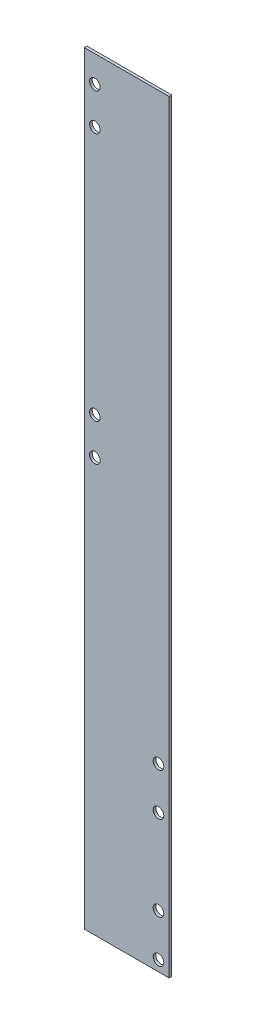
from build123d import *

# Parameters (mm, degrees)
SKETCH1_W          = 3.175
SKETCH1_H          = 914.4
EXTRUDE1_DEPTH     = 101.6
SKETCH3_R          = 6.35
CUT_EXTRUDE2_DEPTH = 50.8
SKETCH4_R          = 6.35
CUT_EXTRUDE3_DEPTH = 50.8


with BuildPart() as part:
    # Sketch1 → Extrude1 (new body)
    with BuildSketch(Plane(origin=(0, 0, 0), x_dir=(0, 0, -1), z_dir=(1, 0, 0))):
        with Locations((1.5875, -457.2)):
            Rectangle(SKETCH1_W, SKETCH1_H)
    extrude(amount=EXTRUDE1_DEPTH)

    # Sketch3 → Cut-Extrude2 (cut)
    with BuildSketch(Plane.XY):
        with Locations((88.9, -901.7)):
            Circle(SKETCH3_R)
        with Locations((88.9, -850.9)):
            Circle(SKETCH3_R)
        with Locations((88.9, -749.3)):
            Circle(SKETCH3_R)
        with Locations((88.9, -698.5)):
            Circle(SKETCH3_R)
    extrude(amount=-CUT_EXTRUDE2_DEPTH, mode=Mode.SUBTRACT)

    # Sketch4 → Cut-Extrude3 (cut)
    with BuildSketch(Plane.XY):
        with Locations((12.7, -419.1)):
            Circle(SKETCH4_R)
        with Locations((12.7, -374.65)):
            Circle(SKETCH4_R)
        with Locations((12.7, -76.2)):
            Circle(SKETCH4_R)
        with Locations((12.7, -31.75)):
            Circle(SKETCH4_R)
    extrude(amount=-CUT_EXTRUDE3_DEPTH, mode=Mode.SUBTRACT)


solid = part.part
